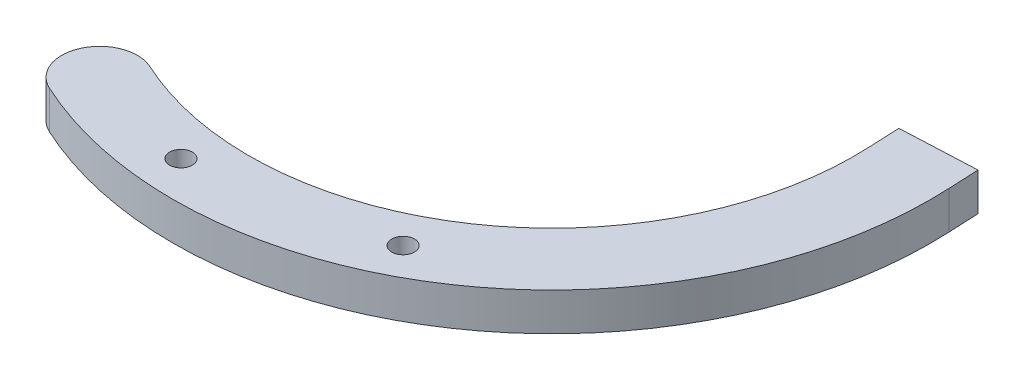
from build123d import *

# Parameters (mm, degrees)
EXTRUDE_1_DEPTH     = 5
CUT_EXTRUDE_1_REACH = 82.779
SKETCH_2_R          = 1.5


with BuildPart() as part:
    # 草图1 → 凸台-拉伸1 (new body)
    with BuildSketch(Plane(origin=(0, 0, 0), x_dir=(1, 0, 0), z_dir=(0, 1, 0))):
        with BuildLine():
            Line((61.023746461, 33.569203074), (60.837080184, 37.600567015))
            Line((60.837080184, 37.600567015), (70.826313722, 38.06310353))
            Line((70.826313722, 38.06310353), (71.011329506, 34.067384676))
            ThreePointArc((71.011329506, 34.067384676), (49.082411457, -9.842070835), (0.164945446, -13.841976975))
            ThreePointArc((0.164945446, -13.841976975), (-2.286053035, -7.209284728), (4.346639213, -4.758286247))
            ThreePointArc((4.346639213, -4.758286247), (43.480612021, -1.558361335), (61.023746461, 33.569203074))
        make_face()
    extrude(amount=EXTRUDE_1_DEPTH)

    # 草图2 → 切除-拉伸1 (cut, up to next)
    with BuildSketch(Plane(origin=(0, 5, 0), x_dir=(1, 0, 0), z_dir=(0, 1, 0)), mode=Mode.PRIVATE) as cut_extrude_1_sk1:
        with Locations(Location((16.930413815, -13.232401329, 0), (0, 0, 270))):
            Circle(SKETCH_2_R)
    cut_extrude_1_tool1 = extrude(cut_extrude_1_sk1.sketch, amount=-CUT_EXTRUDE_1_REACH, mode=Mode.PRIVATE) & part.part
    # 草图2 → 切除-拉伸1 (cut, up to next)
    with BuildSketch(Plane(origin=(0, 5, 0), x_dir=(1, 0, 0), z_dir=(0, 1, 0)), mode=Mode.PRIVATE) as cut_extrude_1_sk2:
        with Locations(Location((41.522785914, -8.508722595, 0), (0, 0, 270))):
            Circle(SKETCH_2_R)
    cut_extrude_1_tool2 = extrude(cut_extrude_1_sk2.sketch, amount=-CUT_EXTRUDE_1_REACH, mode=Mode.PRIVATE) & part.part
    add(cut_extrude_1_tool1.solids().sort_by_distance((16.930414, 5, 13.232401))[0], mode=Mode.SUBTRACT)
    add(cut_extrude_1_tool2.solids().sort_by_distance((41.522786, 5, 8.508723))[0], mode=Mode.SUBTRACT)


solid = part.part
